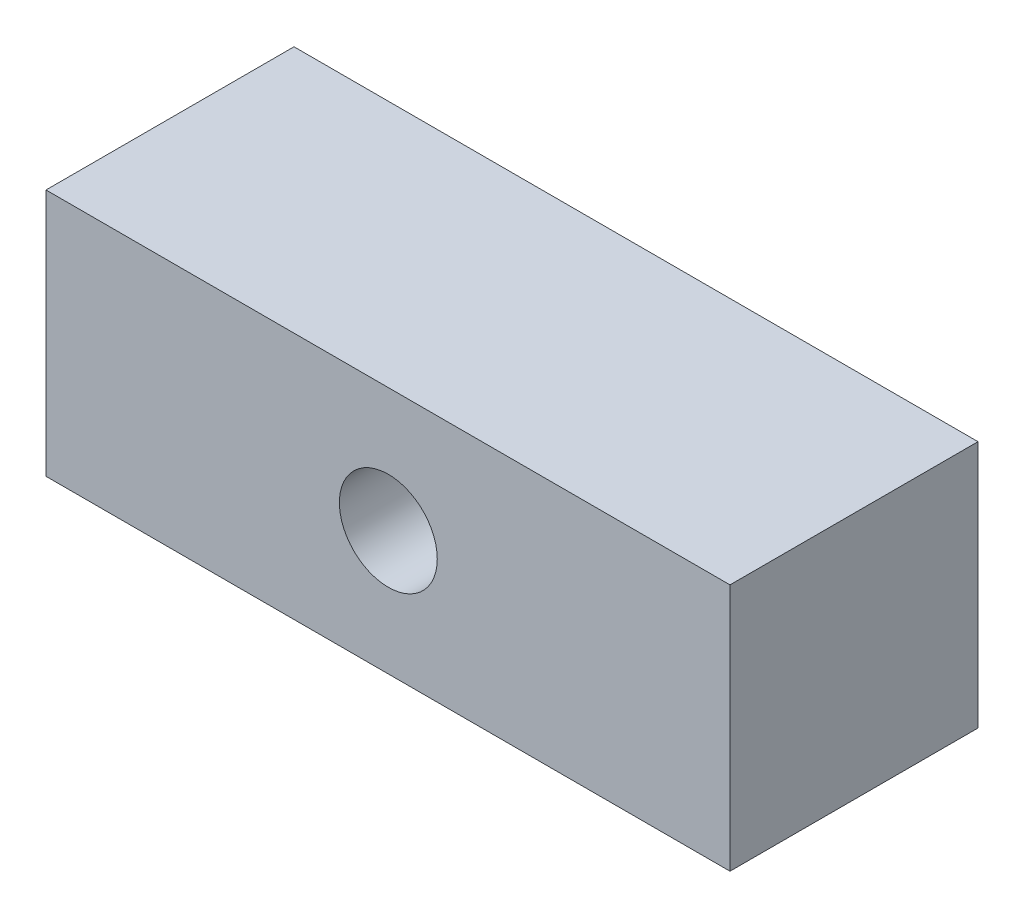
from build123d import *

# Parameters (mm, degrees)
SKETCH1_W           = 104.8
SKETCH1_H           = 38
SKETCH1_R           = 7.5
BOSS_EXTRUDE1_DEPTH = 38


with BuildPart() as part:
    # Sketch1 → Boss-Extrude1 (new body)
    with BuildSketch(Plane.XY):
        with Locations((52.4, 19)):
            Rectangle(SKETCH1_W, SKETCH1_H)
        with Locations((52.45, 19)):
            Circle(SKETCH1_R, mode=Mode.SUBTRACT)
    extrude(amount=BOSS_EXTRUDE1_DEPTH)


solid = part.part
